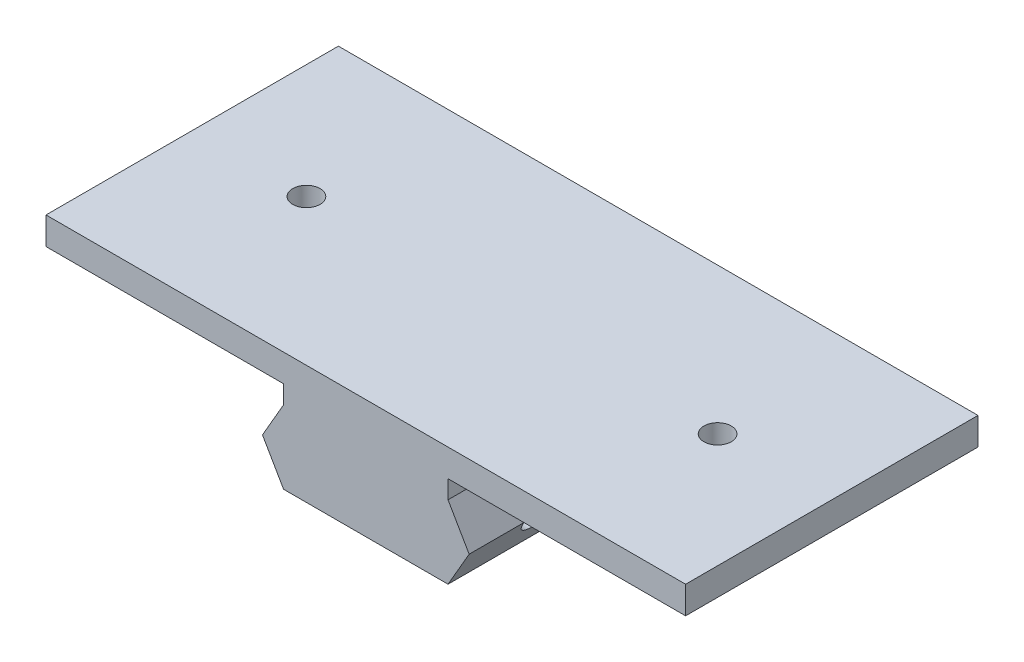
from build123d import *

# Parameters (mm, degrees)
BOSS_EXTRUDE1_DEPTH      = 32
SKETCH2_R                = 2
CUT_EXTRUDE1_DEPTH       = 35.869794274
LPATTERN1_COUNT          = 3
LPATTERN1_PITCH          = 8
BOSS_EXTRUDE2_DEPTH      = 9
BOSS_EXTRUDE2_DEPTH_BACK = 9
SKETCH3_W                = 32
SKETCH3_H                = 2
BOSS_EXTRUDE3_DEPTH      = 35
BOSS_EXTRUDE3_DEPTH_BACK = 35
SKETCH4_W                = 32
SKETCH4_H                = 3
SKETCH5_R                = 1.5
CUT_EXTRUDE2_DEPTH       = 10


with BuildPart() as part:
    # Sketch1 → Boss-Extrude1 (new body)
    with BuildSketch(Plane.XY):
        Polygon((9, 0), (-9, 0), (-11.309401077, 4), (-9, 8), (9, 8), (11.309401077, 4), align=None)
    extrude(amount=BOSS_EXTRUDE1_DEPTH)

    # Sketch2 → Cut-Extrude1 (cut, symmetric)
    with BuildSketch(Plane(origin=(0, 0, 0), x_dir=(0, 0, -1), z_dir=(1, 0, 0))):
        with Locations((-24, 4)):
            Circle(SKETCH2_R)
    cut_extrude1 = extrude(amount=CUT_EXTRUDE1_DEPTH, both=True, mode=Mode.SUBTRACT)

    # LPattern1: Cut-Extrude1 ×3
    with Locations(*[(0, 0, -i * LPATTERN1_PITCH) for i in range(1, LPATTERN1_COUNT)]):
        add(cut_extrude1, mode=Mode.SUBTRACT)

    # Sketch3 → Boss-Extrude2 (add, two sides: drawn at the far end of the back side and taken through both)
    with BuildSketch(Plane(origin=(0, 0, 0), x_dir=(0, 0, -1), z_dir=(1, 0, 0)).offset(-BOSS_EXTRUDE2_DEPTH_BACK)):
        with Locations((-16, 9)):
            Rectangle(SKETCH3_W, SKETCH3_H)
    extrude(amount=BOSS_EXTRUDE2_DEPTH + BOSS_EXTRUDE2_DEPTH_BACK)

    # Sketch4 → Boss-Extrude3 (add, two sides: drawn at the far end of the back side and taken through both)
    with BuildSketch(Plane(origin=(0, 0, 0), x_dir=(0, 0, -1), z_dir=(1, 0, 0)).offset(-BOSS_EXTRUDE3_DEPTH_BACK)):
        with Locations((-16, 11.5)):
            Rectangle(SKETCH4_W, SKETCH4_H)
    extrude(amount=BOSS_EXTRUDE3_DEPTH + BOSS_EXTRUDE3_DEPTH_BACK)

    # Sketch5 → Cut-Extrude2 (cut)
    with BuildSketch(Plane(origin=(0, 13, 0), x_dir=(1, 0, 0), z_dir=(0, 1, 0))):
        with Locations(Location((-22.5, -16, 0), (0, 0, 270))):
            Circle(SKETCH5_R)
        with Locations(Location((22.5, -16, 0), (0, 0, 270))):
            Circle(SKETCH5_R)
    extrude(amount=-CUT_EXTRUDE2_DEPTH, mode=Mode.SUBTRACT)


solid = part.part
